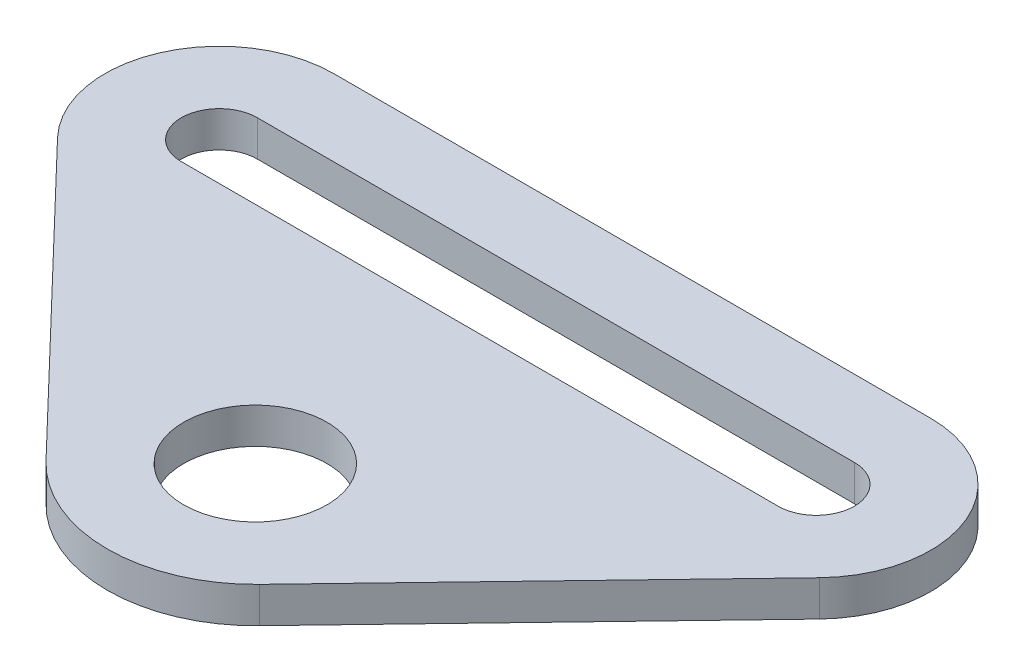
from build123d import *

# Parameters (mm, degrees)
SKETCH1_R           = 6
BOSS_EXTRUDE1_DEPTH = 3


with BuildPart() as part:
    # Sketch1 → Boss-Extrude1 (new body)
    with BuildSketch(Plane(origin=(0, 0, 0), x_dir=(1, 0, 0), z_dir=(0, 1, 0))):
        with BuildLine():
            Line((25, 31.568910727), (-25, 31.568910727))
            ThreePointArc((-25, 31.568910727), (-33.816672086, 25.743188919), (-31.915264344, 15.348123269))
            Line((-31.915264344, 15.348123269), (-8.946703241, -8.585831417))
            ThreePointArc((-8.946703241, -8.585831417), (0, -12.4), (8.946703241, -8.585831417))
            Line((8.946703241, -8.585831417), (31.915264344, 15.348123269))
            ThreePointArc((31.915264344, 15.348123269), (33.816672086, 25.743188919), (25, 31.568910727))
        make_face()
        with Locations(Location((0, 0, 0), (0, 0, 270))):
            Circle(SKETCH1_R, mode=Mode.SUBTRACT)
        with BuildLine():
            Line((-25, 25.168910727), (25, 25.168910727))
            ThreePointArc((25, 25.168910727), (28.184455364, 21.984455364), (25, 18.8))
            Line((25, 18.8), (-25, 18.8))
            ThreePointArc((-25, 18.8), (-28.184455364, 21.984455364), (-25, 25.168910727))
        make_face(mode=Mode.SUBTRACT)
    extrude(amount=BOSS_EXTRUDE1_DEPTH)


solid = part.part
